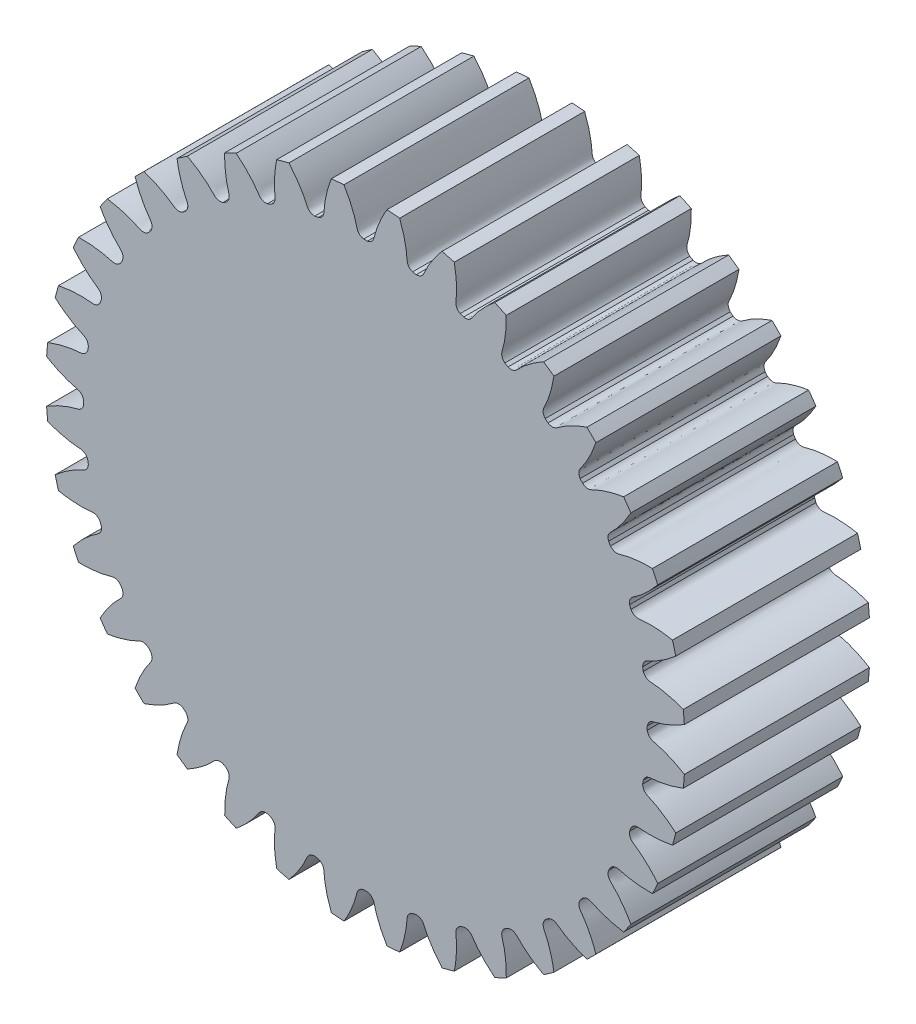
from build123d import *

# Parameters (mm, degrees)
SKETCH_1_R               = 9.5
EXTRUDE_1_DEPTH          = 5.5
CUT_EXTRUDE_1_DEPTH      = 15.517231141
PATTERN_CIRCULAR_1_COUNT = 36


with BuildPart() as part:
    # 草图1 → 凸台-拉伸1 (new body)
    with BuildSketch(Plane.XY):
        Circle(SKETCH_1_R)
    extrude(amount=EXTRUDE_1_DEPTH)

    # 草图2 → 切除-拉伸1 (cut, through all)
    with BuildSketch(Plane.XY):
        with BuildLine():
            ThreePointArc((0.054934474, 8.374819831), (0, 8.375), (-0.054934474, 8.374819831))
            add(Edge.make_bspline(
                [(-0.054934474, 8.374819831), (-0.234978953, 8.415201319), (-0.250497423, 8.549314662), (-0.288218357, 8.691373568), (-0.299748628, 8.731851177), (-0.31309989, 8.775314366), (-0.328367396, 8.821718829), (-0.34568221, 8.870999935), (-0.365162519, 8.923094297), (-0.386928046, 8.977933385), (-0.411095645, 9.035445483), (-0.437780475, 9.09555517), (-0.467095531, 9.15818354), (-0.499151661, 9.223248205), (-0.534057436, 9.290663368), (-0.571919068, 9.360339873), (-0.612840323, 9.432185269), (-0.656922424, 9.506103874), (-0.704263969, 9.581996838), (-0.754960844, 9.659762209), (-0.809106137, 9.739295006), (-0.866790057, 9.820487287), (-0.928099853, 9.903228226), (-0.993119734, 9.987404187), (-1.061930793, 10.072898798), (-1.134610932, 10.15959304), (-1.211234787, 10.247365317), (-1.291873657, 10.33609155), (-1.376595441, 10.425645255), (-1.46546454, 10.515897632), (-1.591181957, 10.63856609), (-1.689482035, 10.72881939), (-1.757006718, 10.78843362)],
                knots=[0, 0, 0, 0, 0.120371484, 0.133302531, 0.147363917, 0.16255564, 0.178877702, 0.196330101, 0.214912839, 0.234625915, 0.25546933, 0.277443082, 0.300547173, 0.324781601, 0.350146368, 0.376641473, 0.404266917, 0.433022698, 0.462908818, 0.493925275, 0.526072071, 0.559349205, 0.593756678, 0.629294488, 0.665962637, 0.703761124, 0.742689949, 0.782749112, 0.823938613, 0.866258453, 0.90970863, 1, 1, 1, 1], degree=3))
            ThreePointArc((-1.757006718, 10.78843362), (0, 10.930570551), (1.757006718, 10.78843362))
            add(Edge.make_bspline(
                [(0.054934474, 8.374819831), (0.234978953, 8.415201319), (0.250497423, 8.549314662), (0.288218357, 8.691373568), (0.299748628, 8.731851177), (0.31309989, 8.775314366), (0.328367396, 8.821718829), (0.34568221, 8.870999935), (0.365162519, 8.923094297), (0.386928046, 8.977933385), (0.411095645, 9.035445483), (0.437780475, 9.09555517), (0.467095531, 9.15818354), (0.499151661, 9.223248205), (0.534057436, 9.290663368), (0.571919068, 9.360339873), (0.612840323, 9.432185269), (0.656922424, 9.506103874), (0.704263969, 9.581996838), (0.754960844, 9.659762209), (0.809106137, 9.739295006), (0.866790057, 9.820487287), (0.928099853, 9.903228226), (0.993119734, 9.987404187), (1.061930793, 10.072898798), (1.134610932, 10.15959304), (1.211234787, 10.247365317), (1.291873657, 10.33609155), (1.376595441, 10.425645255), (1.46546454, 10.515897632), (1.591181957, 10.63856609), (1.689482035, 10.72881939), (1.757006718, 10.78843362)],
                knots=[0, 0, 0, 0, 0.120371484, 0.133302531, 0.147363917, 0.16255564, 0.178877702, 0.196330101, 0.214912839, 0.234625915, 0.25546933, 0.277443082, 0.300547173, 0.324781601, 0.350146368, 0.376641473, 0.404266917, 0.433022698, 0.462908818, 0.493925275, 0.526072071, 0.559349205, 0.593756678, 0.629294488, 0.665962637, 0.703761124, 0.742689949, 0.782749112, 0.823938613, 0.866258453, 0.90970863, 1, 1, 1, 1], degree=3))
        make_face()
    cut_extrude_1 = extrude(amount=CUT_EXTRUDE_1_DEPTH, mode=Mode.SUBTRACT)

    # 阵列(圆周)1: 切除-拉伸1 ×36 about axis
    pattern_circular_1_axis = Axis((0, 0, 5.5), (0, 0, -1))
    for i in range(1, PATTERN_CIRCULAR_1_COUNT):
        add(cut_extrude_1.rotate(pattern_circular_1_axis, i * 360 / PATTERN_CIRCULAR_1_COUNT), mode=Mode.SUBTRACT)


solid = part.part
